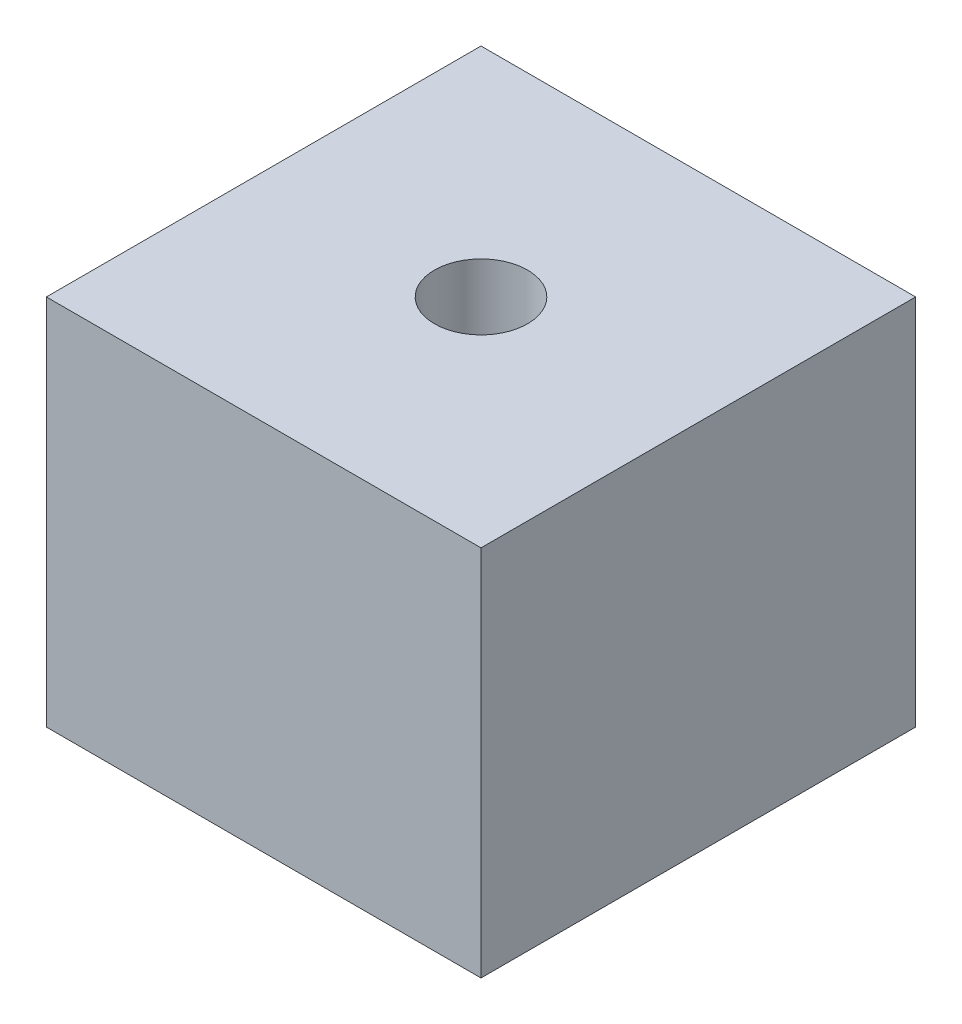
from build123d import *

# Parameters (mm, degrees)
SKETCH1_W           = 88.9
SKETCH1_H           = 88.9
BOSS_EXTRUDE1_DEPTH = 76.2
SKETCH2_R           = 9.525
CUT_EXTRUDE1_DEPTH  = 38.1


with BuildPart() as part:
    # Sketch1 → Boss-Extrude1 (new body)
    with BuildSketch(Plane(origin=(0, 0, 0), x_dir=(1, 0, 0), z_dir=(0, 1, 0))):
        with Locations((44.45, -44.45)):
            Rectangle(SKETCH1_W, SKETCH1_H)
    extrude(amount=BOSS_EXTRUDE1_DEPTH)

    # Sketch2 → Cut-Extrude1 (cut)
    with BuildSketch(Plane(origin=(0, 76.2, 0), x_dir=(1, 0, 0), z_dir=(0, 1, 0))):
        with Locations(Location((44.45, -44.45, 0), (0, 0, 270))):
            Circle(SKETCH2_R)
    extrude(amount=-CUT_EXTRUDE1_DEPTH, mode=Mode.SUBTRACT)


solid = part.part
